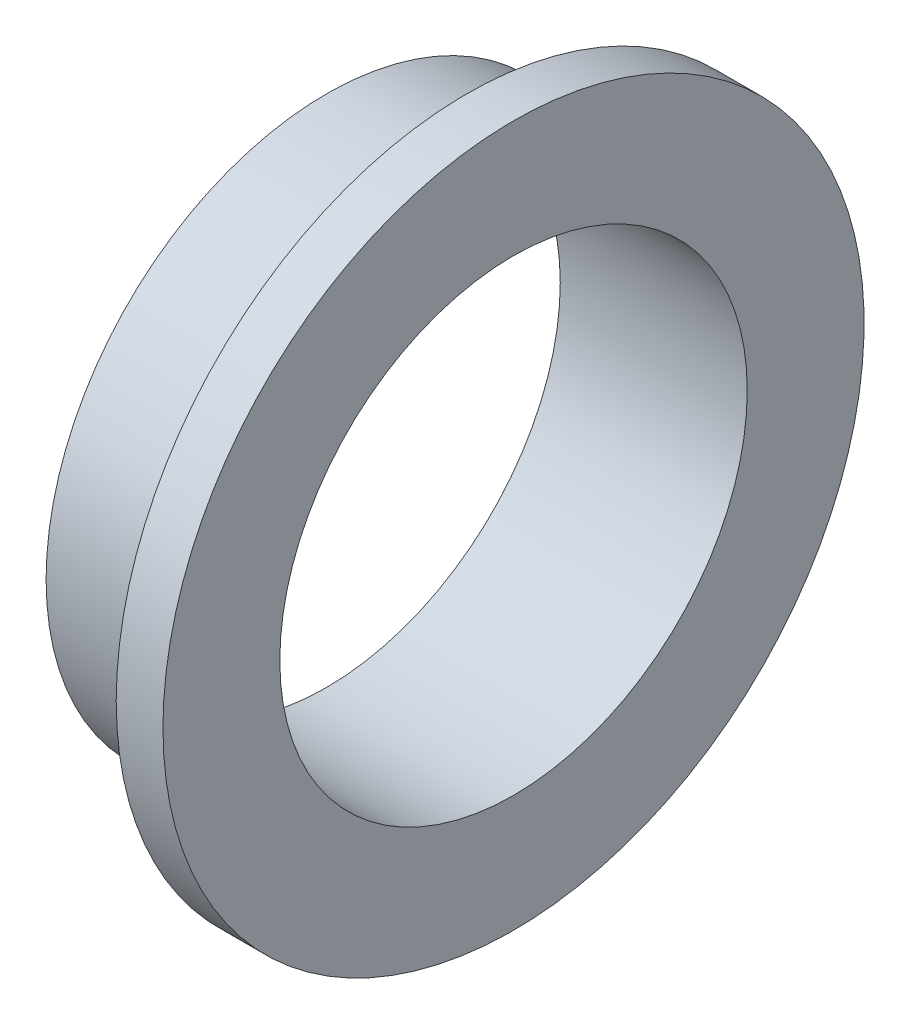
from build123d import *


with BuildPart() as part:
    # Sketch1 → Revolve1 (revolve)
    with BuildSketch(Plane.XY, mode=Mode.PRIVATE) as revolve1_sk:
        Polygon((0, 5), (4, 5), (4, 7.5), (3, 7.5), (3, 6), (0, 6), align=None)
    revolve(revolve1_sk.sketch.rotate(Axis((0, 0, 0), (1, 0, 0)), 90), axis=Axis((0, 0, 0), (1, 0, 0)))


solid = part.part
